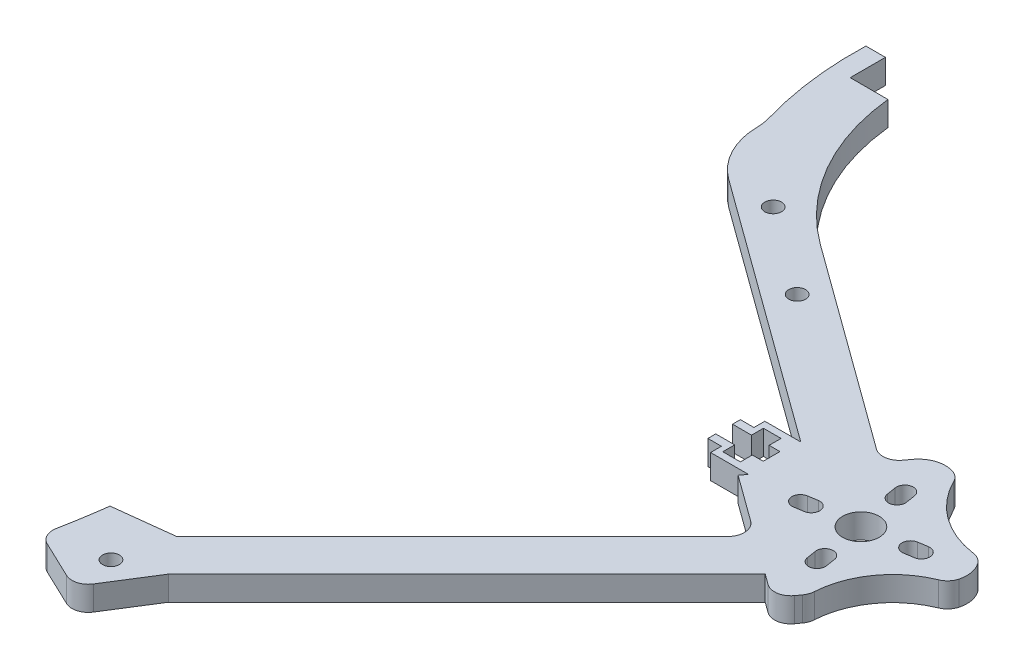
from build123d import *

# Parameters (mm, degrees)
SKETCH_3_R          = 1.55
SKETCH_3_R_2        = 3.375
EXTRUDE_1_DEPTH     = 4.5
FILLET_1_R          = 5
CUT_EXTRUDE_2_REACH = 200.281
FILLET_3_R          = 3
EXTRUDE_5096_DEPTH  = 4.5


with BuildPart() as part:
    # 草图3 → 凸台-拉伸1 (new body)
    with BuildSketch(Plane(origin=(0, 0, 0), x_dir=(1, 0, 0), z_dir=(0, 1, 0))):
        with BuildLine():
            Line((94.694386062, -62.928175745), (41.131907973, -24.012757507))
            ThreePointArc((41.131907973, -24.012757507), (34.497097301, -25.063608282), (35.547948076, -31.698418954))
            Line((35.547948076, -31.698418954), (84.136405992, -67))
            Line((84.136405992, -67), (77.5, -67))
            Line((77.5, -67), (77.5, -69))
            Line((77.5, -69), (75, -69))
            Line((75, -69), (75, -70.45))
            Line((75, -70.45), (78.5, -70.45))
            Line((78.5, -70.45), (78.5, -68.25))
            Line((78.5, -68.25), (81.75, -68.25))
            Line((81.75, -68.25), (81.75, -70.45))
            Line((81.75, -70.45), (83.75, -70.45))
            Line((83.75, -70.45), (83.75, -73.55))
            Line((83.75, -73.55), (81.75, -73.55))
            Line((81.75, -73.55), (81.75, -75.75))
            Line((81.75, -75.75), (78.5, -75.75))
            Line((78.5, -75.75), (78.5, -73.55))
            Line((78.5, -73.55), (75, -73.55))
            Line((75, -73.55), (75, -75))
            Line((75, -75), (77.5, -75))
            Line((77.5, -75), (77.5, -77))
            Line((77.5, -77), (84.136405992, -77))
            Line((84.136405992, -77), (84.470607294, -77))
            Line((84.470607294, -77), (83.673412582, -78.097244389))
            Line((83.673412582, -78.097244389), (94.999650503, -86.326237921))
            Line((94.999650503, -86.326237921), (41.671203749, -139.654684675))
            Line((41.671203749, -139.654684675), (30.676078989, -140.941956792))
            ThreePointArc((30.676078989, -140.941956792), (30.043220441, -145.236869059), (29.290205532, -149.512351472))
            ThreePointArc((29.290205532, -149.512351472), (29.56084749, -151.429597804), (30.946340523, -152.782184076))
            Line((30.946340523, -152.782184076), (40.152805518, -157.170406668))
            Line((40.152805518, -157.170406668), (46.916516286, -146.430187419))
            Line((46.916516286, -146.430187419), (101.962013194, -91.384690511))
            Line((101.962013194, -91.384690511), (106.325888424, -94.555231453))
            Line((106.325888424, -94.555231453), (122.783875489, -71.902755611))
            Line((122.783875489, -71.902755611), (100.131399646, -55.444768547))
            Line((100.131399646, -55.444768547), (94.694386062, -62.928175745))
        make_face()
        with Locations(Location((39.335, -149.432300402, 0), (0, 0, 270))):
            Circle(SKETCH_3_R, mode=Mode.SUBTRACT)
        with Locations(Location((44.044221455, -32, 0), (0, 0, 270))):
            Circle(SKETCH_3_R, mode=Mode.SUBTRACT)
        with Locations(Location((60.224561343, -43.755705046, 0), (0, 0, 270))):
            Circle(SKETCH_3_R, mode=Mode.SUBTRACT)
        with BuildLine():
            ThreePointArc((95.08466389, -74.720558792), (96.858054238, -76.0090023), (95.569610731, -77.782392648))
            Line((95.569610731, -77.782392648), (93.841156135, -78.056152962))
            ThreePointArc((93.841156135, -78.056152962), (92.067765787, -76.767709455), (93.356209294, -74.994319106))
            Line((93.356209294, -74.994319106), (95.08466389, -74.720558792))
        make_face(mode=Mode.SUBTRACT)
        with BuildLine():
            Line((103.222963142, -84.872434742), (102.949202828, -83.143980146))
            ThreePointArc((102.949202828, -83.143980146), (104.237646335, -81.370589797), (106.011036684, -82.659033304))
            Line((106.011036684, -82.659033304), (106.284796997, -84.3874879))
            ThreePointArc((106.284796997, -84.3874879), (104.99635349, -86.160878249), (103.222963142, -84.872434742))
        make_face(mode=Mode.SUBTRACT)
        with Locations(Location((103.228644035, -75, 0), (0, 0, 270))):
            Circle(SKETCH_3_R_2, mode=Mode.SUBTRACT)
        with BuildLine():
            ThreePointArc((111.372624181, -75.279441208), (109.599233832, -73.9909977), (110.887677339, -72.217607352))
            Line((110.887677339, -72.217607352), (112.616131935, -71.943847038))
            ThreePointArc((112.616131935, -71.943847038), (114.389522284, -73.232290545), (113.101078777, -75.005680894))
            Line((113.101078777, -75.005680894), (111.372624181, -75.279441208))
        make_face(mode=Mode.SUBTRACT)
        with BuildLine():
            Line((103.234324929, -65.127565258), (103.508085243, -66.856019854))
            ThreePointArc((103.508085243, -66.856019854), (102.219641736, -68.629410203), (100.446251387, -67.340966696))
            Line((100.446251387, -67.340966696), (100.172491073, -65.6125121))
            ThreePointArc((100.172491073, -65.6125121), (101.46093458, -63.839121751), (103.234324929, -65.127565258))
        make_face(mode=Mode.SUBTRACT)
    extrude(amount=EXTRUDE_1_DEPTH)

    # 圆角-美观1
    fillet_1_edges = [part.edges().sort_by_distance(p)[0] for p in [
        (100.131399646, 2.25, 55.444768547),
        (122.783875489, 2.25, 71.902755611),
    ]]
    fillet(fillet_1_edges, radius=FILLET_1_R)

    # 草图4 → 圆弧-美观2 (cut, up to next)
    with BuildSketch(Plane(origin=(0, 4.5, 0), x_dir=(1, 0, 0), z_dir=(0, 1, 0)), mode=Mode.PRIVATE) as cut_extrude_2_sk1:
        with BuildLine():
            ThreePointArc((118.738790517, -68.963829349), (109.994899962, -65.687047674), (104.176484618, -58.383694808))
            Line((104.176484618, -58.383694808), (118.738790517, -68.963829349))
        make_face()
    cut_extrude_2_tool1 = extrude(cut_extrude_2_sk1.sketch, amount=-CUT_EXTRUDE_2_REACH, mode=Mode.PRIVATE) & part.part
    # 草图4 → 圆弧-美观2 (cut, up to next)
    with BuildSketch(Plane(origin=(0, 4.5, 0), x_dir=(1, 0, 0), z_dir=(0, 1, 0)), mode=Mode.PRIVATE) as cut_extrude_2_sk2:
        with BuildLine():
            Line((119.844949227, -75.947840583), (109.264814686, -90.510146481))
            ThreePointArc((109.264814686, -90.510146481), (112.204348353, -81.521230905), (119.844949227, -75.947840583))
        make_face()
    cut_extrude_2_tool2 = extrude(cut_extrude_2_sk2.sketch, amount=-CUT_EXTRUDE_2_REACH, mode=Mode.PRIVATE) & part.part
    add(cut_extrude_2_tool1.solids().sort_by_distance((110.868828, 4.5, 64.48419))[0], mode=Mode.SUBTRACT)
    add(cut_extrude_2_tool2.solids().sort_by_distance((113.606622, 4.5, 82.540042))[0], mode=Mode.SUBTRACT)

    # 圆角-美观3
    fillet_3_edges = [part.edges().sort_by_distance(p)[0] for p in [
        (94.999650503, 2.25, 86.326237921),
        (94.694386062, 2.25, 62.928175745),
        (106.325888424, 2.25, 94.555231453),
        (40.152805518, 2.25, 157.170406668),
        (118.738790517, 2.25, 68.963829349),
        (104.176484618, 2.25, 58.383694808),
        (119.844949227, 2.25, 75.947840583),
        (109.264814686, 2.25, 90.510146481),
    ]]
    fillet(fillet_3_edges, radius=FILLET_3_R)

    # 草图5 → Extrude 5096 (add)
    with BuildSketch(Plane(origin=(0, 0, 0), x_dir=(1, 0, 0), z_dir=(0, 1, 0))):
        with BuildLine():
            Line((41.131907973, -24.012757507), (54.395000648, -33.648958388))
            ThreePointArc((54.395000648, -33.648958388), (47.749518962, -27.625359459), (42.549937685, -20.317108954))
            ThreePointArc((42.549937685, -20.317108954), (39.186571182, -12.543642943), (37.467706796, -4.25))
            Line((37.467706796, -4.25), (30.5, -4.25))
            Line((30.5, -4.25), (30.5, -3.25))
            Line((30.5, -3.25), (30.5, 2.25))
            Line((30.5, 2.25), (26.902552576, 2.25))
            ThreePointArc((26.902552576, 2.25), (27.35989158, -8.024554542), (29.428853503, -18.099028552))
            ThreePointArc((29.428853503, -18.099028552), (29.710927986, -19.386919832), (29.821122157, -20.700726214))
            ThreePointArc((29.821122157, -20.700726214), (31.390100135, -26.873623403), (35.547948076, -31.698418954))
            Line((35.547948076, -31.698418954), (41.131907973, -24.012757507))
        make_face()
    extrude(amount=EXTRUDE_5096_DEPTH)


solid = part.part
